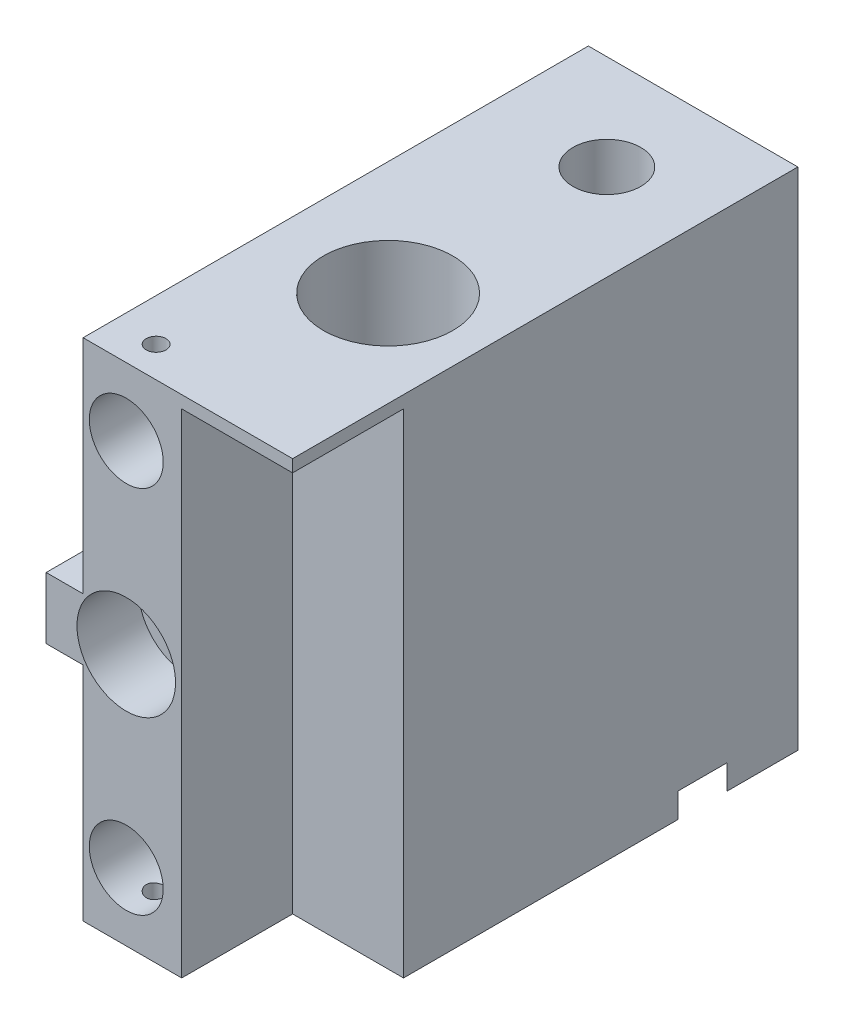
from build123d import *
from build123d.topology import SkipClean

# Parameters (mm, degrees)
SKETCH1_W           = 40
SKETCH1_H           = 82
SKETCH1_R           = 5.5
SKETCH1_R_2         = 6
BOSS_EXTRUDE1_DEPTH = 12
BOSS_EXTRUDE2_START = 70
SKETCH2_W           = 40
SKETCH2_H           = 82
SKETCH2_R           = 5.5
BOSS_EXTRUDE2_DEPTH = 70
SKETCH3_R           = 1.6
CUT_EXTRUDE1_DEPTH  = 10
CUT_EXTRUDE2_START  = -10
SKETCH4_R           = 1.6
CUT_EXTRUDE2_DEPTH  = 10
SKETCH5_R           = 10.5
SKETCH5_R_2         = 5.5
CUT_EXTRUDE3_DEPTH  = 100
SKETCH6_R           = 16
CUT_EXTRUDE4_DEPTH  = 4
SKETCH19_R          = 8.05
CUT_EXTRUDE17_DEPTH = 16
SKETCH12_R          = 1.2
CUT_EXTRUDE12_DEPTH = 12
SKETCH13_W          = 20
SKETCH13_H          = 70
BOSS_EXTRUDE3_DEPTH = 30
SKETCH14_R          = 2
CUT_EXTRUDE13_DEPTH = 12
CUT_EXTRUDE14_DEPTH = 115
SKETCH18_R          = 19.1
CUT_EXTRUDE16_DEPTH = 2
SKETCH22_W          = 18
SKETCH22_H          = 18
CUT_EXTRUDE18_DEPTH = 80
SKETCH23_R          = 8
CUT_EXTRUDE19_DEPTH = 10


with BuildPart() as part:
    # Sketch1 → Boss-Extrude1 (new body)
    with BuildSketch(Plane.XY):
        with Locations((-20, -41)):
            Rectangle(SKETCH1_W, SKETCH1_H)
        with Locations((-27, -41)):
            Circle(SKETCH1_R, mode=Mode.SUBTRACT)
        with Locations((-27, -11)):
            Circle(SKETCH1_R_2, mode=Mode.SUBTRACT)
        with Locations((-27, -71)):
            Circle(SKETCH1_R_2, mode=Mode.SUBTRACT)
    extrude(amount=BOSS_EXTRUDE1_DEPTH)

    # Sketch2 → Boss-Extrude2 (add)
    with SkipClean():  # the faces are left unmerged after this step: merging them gives an invalid solid
        with BuildSketch(Plane(origin=(0, 0, 0), x_dir=(-1, 0, 0), z_dir=(0, 0, -1)).offset(BOSS_EXTRUDE2_START)):
            with Locations((20, -41)):
                Rectangle(SKETCH2_W, SKETCH2_H)
            with Locations((27, -41)):
                Circle(SKETCH2_R, mode=Mode.SUBTRACT)
        extrude(amount=-BOSS_EXTRUDE2_DEPTH)

    # Sketch3 → Cut-Extrude1 (cut)
    with SkipClean():  # the faces are left unmerged after this step: merging them gives an invalid solid
        with BuildSketch(Plane(origin=(0, 0, 0), x_dir=(1, 0, 0), z_dir=(0, 1, 0))):
            with Locations(Location((-27.154767421, -7, 0), (0, 0, 270))):
                Circle(SKETCH3_R)
        extrude(amount=-CUT_EXTRUDE1_DEPTH, mode=Mode.SUBTRACT)

    # Sketch4 → Cut-Extrude2 (cut)
    with SkipClean():  # the faces are left unmerged after this step: merging them gives an invalid solid
        with BuildSketch(Plane.XZ.offset(82).offset(CUT_EXTRUDE2_START)):
            with Locations(Location((-27.154767421, 7, 0), (0, 0, 90))):
                Circle(SKETCH4_R)
        extrude(amount=CUT_EXTRUDE2_DEPTH, mode=Mode.SUBTRACT)

    # Sketch5 → Cut-Extrude3 (cut)
    with SkipClean():  # the faces are left unmerged after this step: merging them gives an invalid solid
        with BuildSketch(Plane(origin=(0, 0, 0), x_dir=(1, 0, 0), z_dir=(0, 1, 0))):
            with Locations(Location((-15.5, 19, 0), (0, 0, 270))):
                Circle(SKETCH5_R)
            with Locations(Location((-15.5, 54.5, 0), (0, 0, 270))):
                Circle(SKETCH5_R_2)
        extrude(amount=-CUT_EXTRUDE3_DEPTH, mode=Mode.SUBTRACT)

    # Sketch6 → Cut-Extrude4 (cut)
    with SkipClean():  # the faces are left unmerged after this step: merging them gives an invalid solid
        with BuildSketch(Plane(origin=(0, -82, 0), x_dir=(1, 0, 0), z_dir=(0, 1, 0))):
            with Locations((-15.5, 54.5)):
                Circle(SKETCH6_R)
        extrude(amount=CUT_EXTRUDE4_DEPTH, mode=Mode.SUBTRACT)

    # Sketch19 → Cut-Extrude17 (cut)
    with SkipClean():  # the faces are left unmerged after this step: merging them gives an invalid solid
        with BuildSketch(Plane(origin=(0, -78, 0), x_dir=(-1, 0, 0), z_dir=(0, -1, 0))):
            with Locations(Location((15.5, 54.5, 0), (0, 0, 180))):
                Circle(SKETCH19_R)
        extrude(amount=-CUT_EXTRUDE17_DEPTH, mode=Mode.SUBTRACT)

    # Sketch12 → Cut-Extrude12 (cut)
    with SkipClean():  # the faces are left unmerged after this step: merging them gives an invalid solid
        with BuildSketch(Plane(origin=(0, -78, 0), x_dir=(-1, 0, 0), z_dir=(0, -1, 0))):
            with Locations(Location((11.517229373, 43.180214749, 0), (0, 0, 180))):
                Circle(SKETCH12_R)
            with Locations(Location((26.819785251, 50.517229373, 0), (0, 0, 180))):
                Circle(SKETCH12_R)
            with Locations(Location((19.482770627, 65.819785251, 0), (0, 0, 180))):
                Circle(SKETCH12_R)
            with Locations(Location((4.180214749, 58.482770627, 0), (0, 0, 180))):
                Circle(SKETCH12_R)
        extrude(amount=-CUT_EXTRUDE12_DEPTH, mode=Mode.SUBTRACT)

    # Sketch13 → Boss-Extrude3 (add)
    with SkipClean():  # the faces are left unmerged after this step: merging them gives an invalid solid
        with BuildSketch(Plane(origin=(0, 0, -70), x_dir=(-1, 0, 0), z_dir=(0, 0, -1))):
            with Locations((50, -35)):
                Rectangle(SKETCH13_W, SKETCH13_H)
        extrude(amount=-BOSS_EXTRUDE3_DEPTH)

    # Sketch14 → Cut-Extrude13 (cut)
    with SkipClean():  # the faces are left unmerged after this step: merging them gives an invalid solid
        with BuildSketch(Plane(origin=(0, 0, -70), x_dir=(-1, 0, 0), z_dir=(0, 0, -1))):
            with Locations((50.54, -41)):
                Circle(SKETCH14_R)
            with Locations((27, -17.46)):
                Circle(SKETCH14_R)
            with Locations((3.46, -41)):
                Circle(SKETCH14_R)
            with Locations((27, -64.54)):
                Circle(SKETCH14_R)
        extrude(amount=-CUT_EXTRUDE13_DEPTH, mode=Mode.SUBTRACT)

    # Sketch15 → Cut-Extrude14 (cut)
    with SkipClean():  # the faces are left unmerged after this step: merging them gives an invalid solid
        with BuildSketch(Plane(origin=(0, 0, -70), x_dir=(-1, 0, 0), z_dir=(0, 0, -1))):
            Polygon((34, 0), (34, -36), (54.581085422, -36), (54.581085422, -46), (34, -46), (34, -82), (77.520554958, -82), (77.520554958, 0), align=None)
        extrude(amount=-CUT_EXTRUDE14_DEPTH, mode=Mode.SUBTRACT)

    # Sketch18 → Cut-Extrude16 (cut)
    with SkipClean():  # the faces are left unmerged after this step: merging them gives an invalid solid
        with BuildSketch(Plane(origin=(0, 0, -70), x_dir=(-1, 0, 0), z_dir=(0, 0, -1))):
            with Locations((27, -41)):
                Circle(SKETCH18_R)
        extrude(amount=-CUT_EXTRUDE16_DEPTH, mode=Mode.SUBTRACT)

    # Sketch22 → Cut-Extrude18 (cut)
    with SkipClean():  # the faces are left unmerged after this step: merging them gives an invalid solid
        with BuildSketch(Plane.XZ.offset(82)):
            with Locations((-9, 3)):
                Rectangle(SKETCH22_W, SKETCH22_H)
        extrude(amount=-CUT_EXTRUDE18_DEPTH, mode=Mode.SUBTRACT)

    # Sketch23 → Cut-Extrude19 (cut)
    with BuildSketch(Plane.XY.offset(12)):
        with Locations((-27, -41)):
            Circle(SKETCH23_R)
    extrude(amount=-CUT_EXTRUDE19_DEPTH, mode=Mode.SUBTRACT)


solid = part.part
